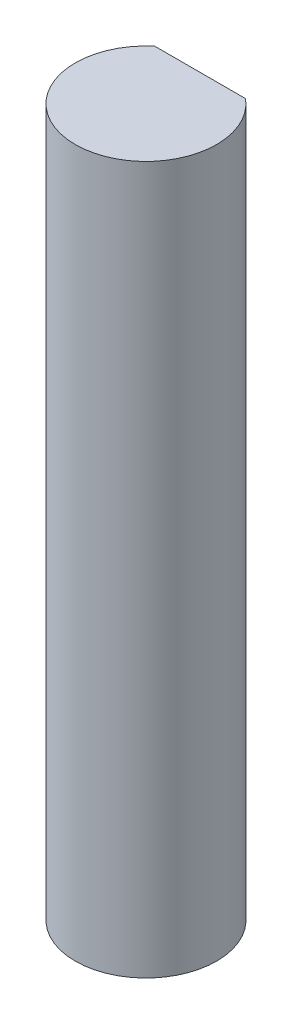
from build123d import *

# Parameters (mm, degrees)
SKETCH_1_R          = 3
EXTRUDE_1_DEPTH     = 30
SKETCH_2_W          = 5
SKETCH_2_H          = 2
CUT_EXTRUDE_1_DEPTH = 31.298514815


with BuildPart() as part:
    # Эскиз1 → Бобышка-Вытянуть1 (new body)
    with BuildSketch(Plane(origin=(0, 0, 0), x_dir=(1, 0, 0), z_dir=(0, 1, 0))):
        with Locations(Location((0, 0, 0), (0, 0, 270))):
            Circle(SKETCH_1_R)
    extrude(amount=EXTRUDE_1_DEPTH)

    # Эскиз2 → Вырез-Вытянуть1 (cut, through all)
    with BuildSketch(Plane(origin=(0, 30, 0), x_dir=(1, 0, 0), z_dir=(0, 1, 0))):
        with Locations((0, 3.3)):
            Rectangle(SKETCH_2_W, SKETCH_2_H)
    extrude(amount=-CUT_EXTRUDE_1_DEPTH, mode=Mode.SUBTRACT)


solid = part.part
